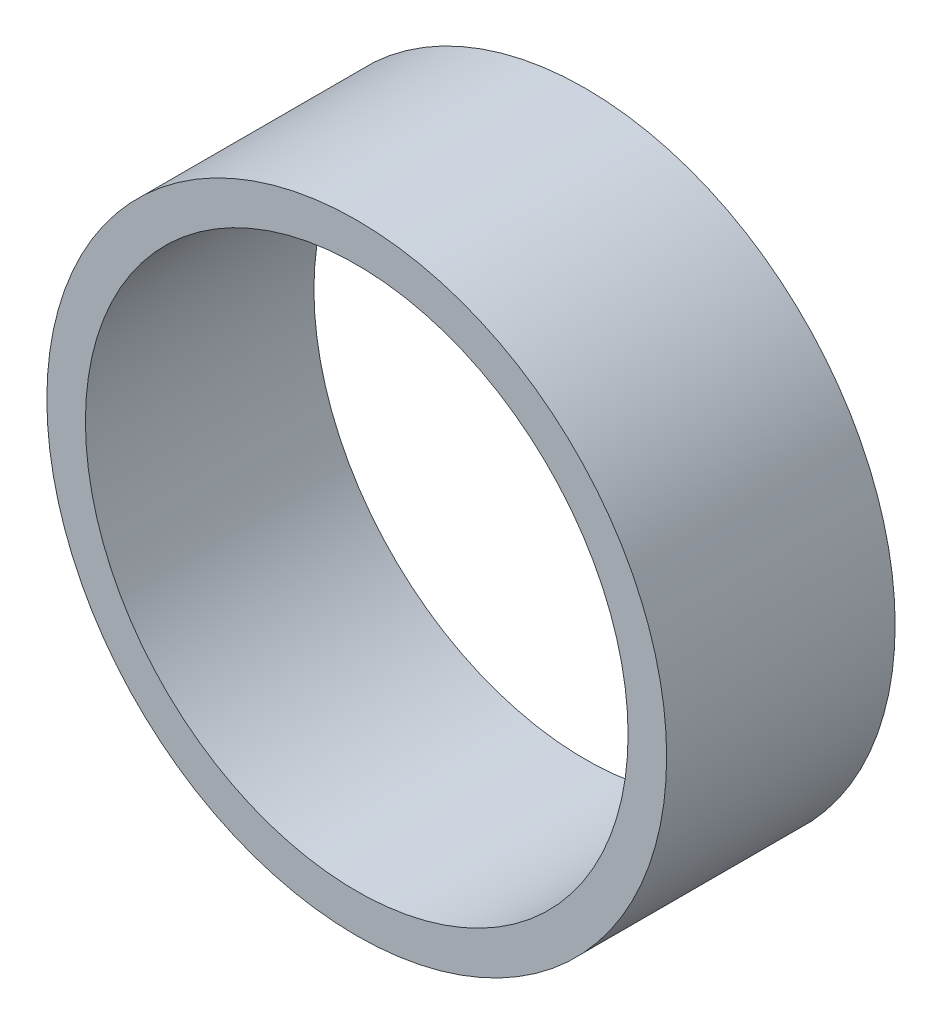
from build123d import *

# Parameters (mm, degrees)
SKETCH2_R           = 5.425
SKETCH2_R_2         = 4.75
BOSS_EXTRUDE1_DEPTH = 4


with BuildPart() as part:
    # Sketch2 → Boss-Extrude1 (new body)
    with BuildSketch(Plane.XY):
        Circle(SKETCH2_R)
        Circle(SKETCH2_R_2, mode=Mode.SUBTRACT)
    extrude(amount=BOSS_EXTRUDE1_DEPTH)


solid = part.part
